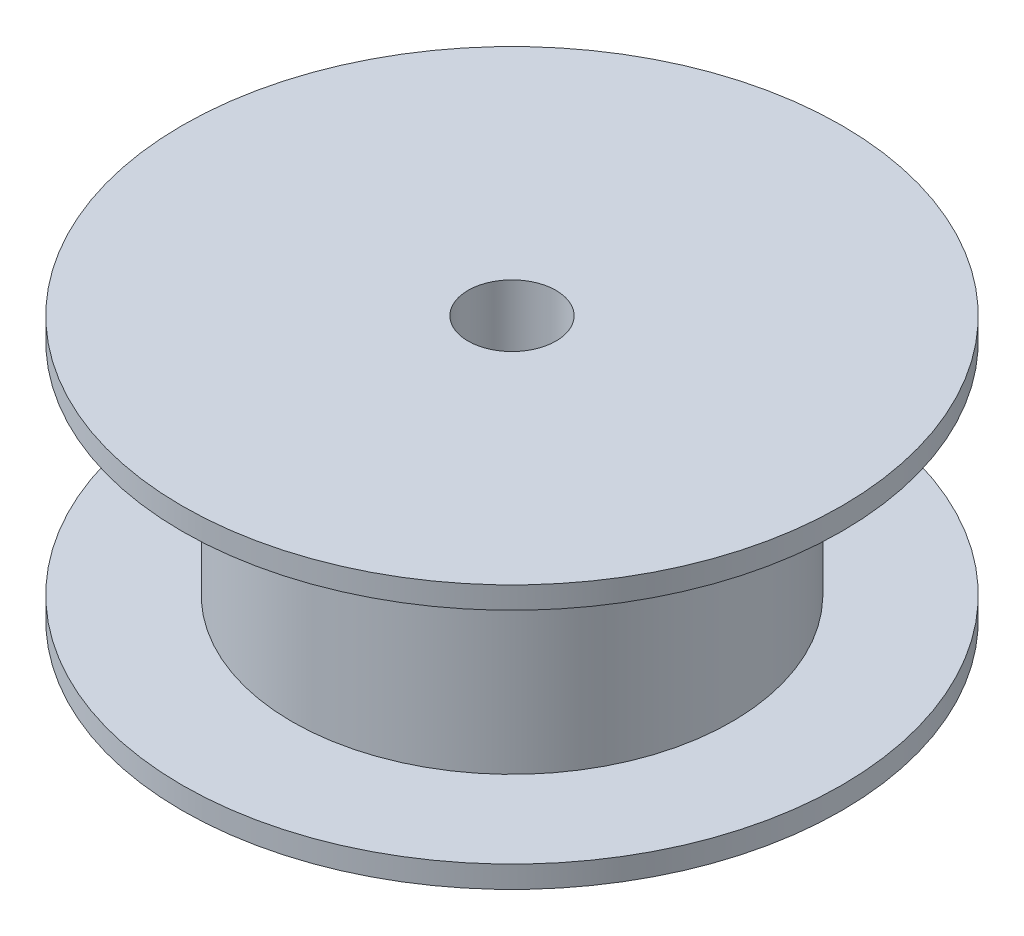
from build123d import *

# Parameters (mm, degrees)
SKETCH_1_R      = 10
SKETCH_1_R_2    = 2
EXTRUDE_1_DEPTH = 10
SKETCH_2_R      = 15
SKETCH_2_R_2    = 2
EXTRUDE_2_DEPTH = 1
EXTRUDE_START   = 1
SKETCH_3_R      = 15
SKETCH_3_R_2    = 2
EXTRUDE_3_DEPTH = 1


with BuildPart() as part:
    # 草图1 → 凸台-拉伸1 (new body)
    with BuildSketch(Plane(origin=(0, 0, 0), x_dir=(1, 0, 0), z_dir=(0, 1, 0))):
        with Locations(Location((0, 0, 0), (0, 0, 270))):
            Circle(SKETCH_1_R)
        with Locations(Location((0, 0, 0), (0, 0, 270))):
            Circle(SKETCH_1_R_2, mode=Mode.SUBTRACT)
    extrude(amount=EXTRUDE_1_DEPTH)

    # 草图2 → 凸台-拉伸2 (add)
    with BuildSketch(Plane(origin=(0, 10, 0), x_dir=(1, 0, 0), z_dir=(0, 1, 0))):
        with Locations(Location((0, 0, 0), (0, 0, 270))):
            Circle(SKETCH_2_R)
        with Locations(Location((0, 0, 0), (0, 0, 270))):
            Circle(SKETCH_2_R_2, mode=Mode.SUBTRACT)
    extrude(amount=EXTRUDE_2_DEPTH)

    # 草图3 → 凸台-拉伸3 (add)
    with BuildSketch(Plane.XZ.offset(EXTRUDE_START)):
        with Locations(Location((0, 0, 0), (0, 0, 90))):
            Circle(SKETCH_3_R)
        with Locations(Location((0, 0, 0), (0, 0, 270))):
            Circle(SKETCH_3_R_2, mode=Mode.SUBTRACT)
    extrude(amount=-EXTRUDE_3_DEPTH)


solid = part.part
